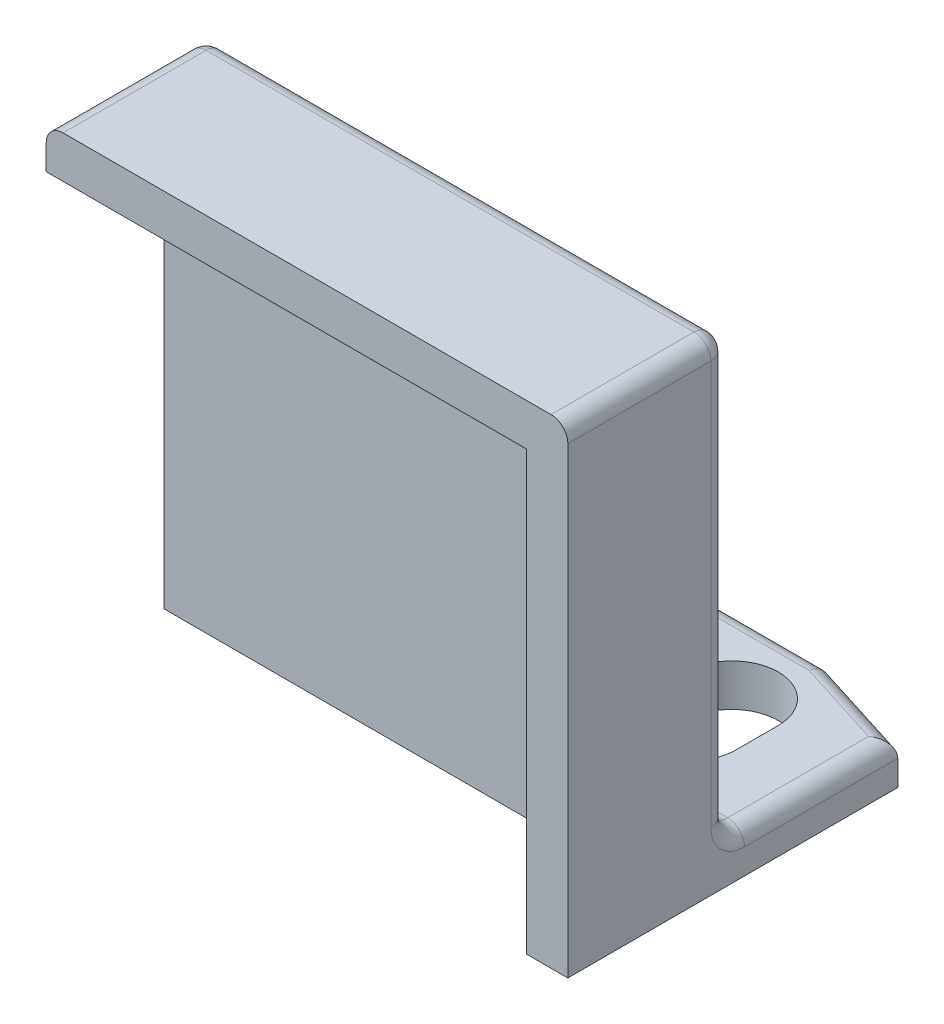
from build123d import *

# Parameters (mm, degrees)
BOSS_EXTRUDE1_DEPTH = 3.175
SKETCH2_W           = 39.37
SKETCH2_H           = 3.175
BOSS_EXTRUDE2_DEPTH = 33.02
SKETCH3_W           = 39.37
SKETCH3_H           = 8.89
SKETCH3_H_2         = 3.175
BOSS_EXTRUDE3_DEPTH = 3.175
SKETCH4_W           = 8.89
SKETCH4_H           = 33.02
BOSS_EXTRUDE4_DEPTH = 3.1242
RIB1_REACH          = 45.93
SKETCH6_WALL_W      = 122.696858414
SKETCH6_WALL_H      = 2.54
FILLET1_R           = 1.27


with BuildPart() as part:
    # Sketch1 → Boss-Extrude1 (new body)
    with BuildSketch(Plane(origin=(0, 0, 0), x_dir=(1, 0, 0), z_dir=(0, 1, 0))):
        Polygon((-12.065, 15.24), (-19.685, 12.838646177), (-19.685, 0), (19.685, 0), (19.685, 12.838646177), (12.065, 15.24), align=None)
        with BuildLine():
            ThreePointArc((-14.295, 9.2075), (-10.795, 12.7075), (-7.295, 9.2075))
            Line((-7.295, 9.2075), (-7.295, 6.0325))
            ThreePointArc((-7.295, 6.0325), (-10.795, 2.5325), (-14.295, 6.0325))
            Line((-14.295, 6.0325), (-14.295, 9.2075))
        make_face(mode=Mode.SUBTRACT)
        with BuildLine():
            Line((7.295, 6.0325), (7.295, 9.2075))
            ThreePointArc((7.295, 9.2075), (10.795, 12.7075), (14.295, 9.2075))
            Line((14.295, 9.2075), (14.295, 6.0325))
            ThreePointArc((14.295, 6.0325), (10.795, 2.5325), (7.295, 6.0325))
        make_face(mode=Mode.SUBTRACT)
    extrude(amount=BOSS_EXTRUDE1_DEPTH)

    # Sketch2 → Boss-Extrude2 (add)
    with BuildSketch(Plane(origin=(0, 0, 0), x_dir=(1, 0, 0), z_dir=(0, 1, 0))):
        with Locations((0, -1.5875)):
            Rectangle(SKETCH2_W, SKETCH2_H)
    extrude(amount=BOSS_EXTRUDE2_DEPTH)

    # Sketch3 → Boss-Extrude3 (add)
    with BuildSketch(Plane(origin=(0, 33.02, 0), x_dir=(1, 0, 0), z_dir=(0, 1, 0))):
        with Locations((0, -7.62)):
            Rectangle(SKETCH3_W, SKETCH3_H)
        with Locations((0, -1.5875)):
            Rectangle(SKETCH3_W, SKETCH3_H_2)
    extrude(amount=BOSS_EXTRUDE3_DEPTH)

    # Sketch4 → Boss-Extrude4 (add)
    with BuildSketch(Plane(origin=(19.685, 0, 0), x_dir=(0, 0, -1), z_dir=(1, 0, 0))):
        with Locations((-7.62, 16.51)):
            Rectangle(SKETCH4_W, SKETCH4_H)
    extrude(amount=-BOSS_EXTRUDE4_DEPTH)

    # Sketch6 wall → Rib1 (add, up to next)
    with BuildSketch(Plane(origin=(0, 18.152288456, -6.726767741), x_dir=(0, -0.912217845065, -0.409705507828), z_dir=(0, 0.409705507828, -0.912217845065)), mode=Mode.PRIVATE) as rib1_sk1:
        Rectangle(SKETCH6_WALL_W, SKETCH6_WALL_H)
    rib1_tool1 = extrude(rib1_sk1.sketch, amount=-RIB1_REACH, mode=Mode.PRIVATE) - part.part
    add(rib1_tool1.solids().sort_by_distance((0, 18.152288456, -6.726767741))[0])

    # Fillet1
    fillet1_edges = [part.edges().sort_by_distance(p)[0] for p in [
        (-1.27, 3.175, -6.726767741),
        (1.27, 3.175, -6.726767741),
        (-1.27, 18.152288456, 0),
        (19.685, 3.175, -6.419323088),
        (15.875, 3.175, -14.039323088),
        (0, 3.175, -15.24),
        (-15.875, 3.175, -14.039323088),
        (-19.685, 3.175, -6.419323088),
        (-10.4775, 3.175, 0),
        (-19.685, 19.685, 0),
        (19.685, 19.685, 0),
        (19.685, 36.195, 6.0325),
        (0, 36.195, 0),
        (-19.685, 36.195, 6.0325),
        (10.4775, 3.175, 0),
        (0, 33.129576912, 0),
        (1.27, 18.152288456, 0),
    ]]
    fillet(fillet1_edges, radius=FILLET1_R)


solid = part.part
